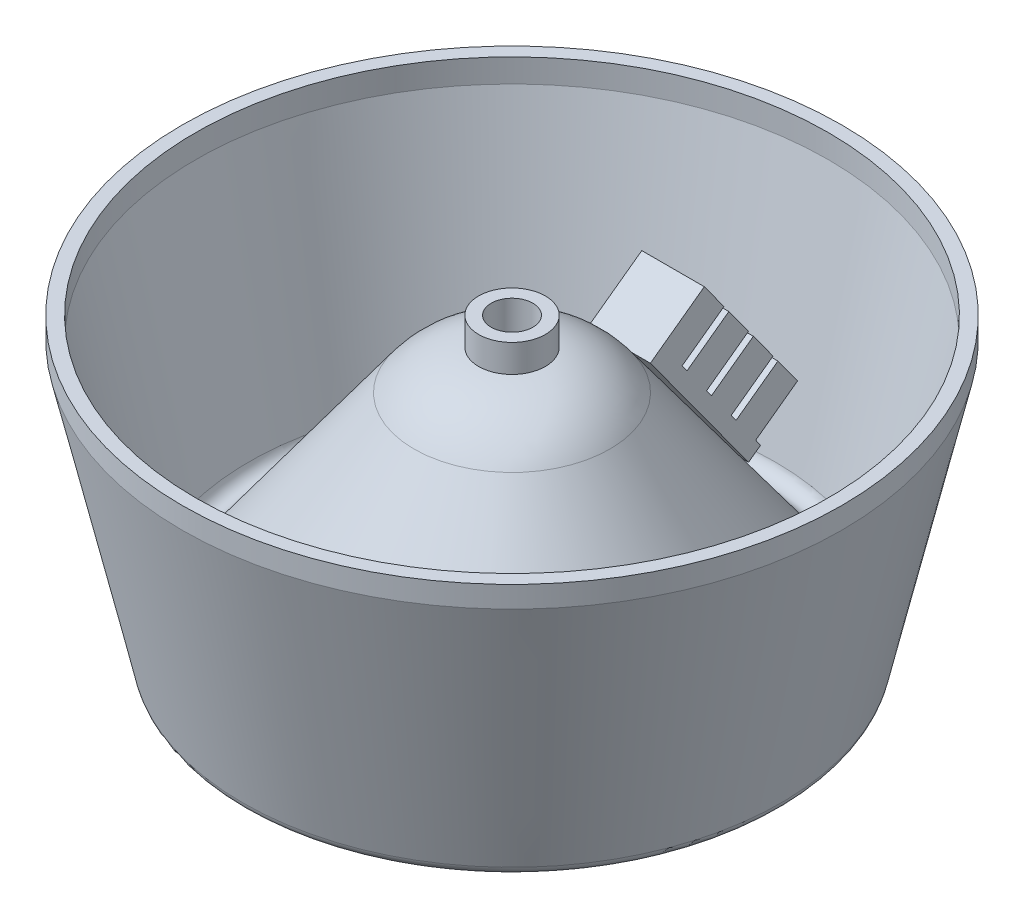
from build123d import *

# Parameters (mm, degrees)
SKETCH2_W           = 15
SKETCH2_H           = 40
BOSS_EXTRUDE3_DEPTH = 1
SKETCH3_W           = 15
SKETCH3_H           = 8
BOSS_EXTRUDE4_DEPTH = 15
SKETCH5_W           = 11
SKETCH5_H           = 6
CUT_EXTRUDE1_DEPTH  = 13
SKETCH6_W           = 15
SKETCH6_H           = 2.584007535
BOSS_EXTRUDE5_DEPTH = 2
LPATTERN1_COUNT     = 4
LPATTERN1_PITCH     = 10


with BuildPart() as part:
    # Sketch1 → Revolve7 (revolve)
    with BuildSketch(Plane(origin=(0, 0, 0), x_dir=(0, 0, -1), z_dir=(1, 0, 0))):
        with BuildLine():
            Line((-59.148631637, -32.404719831), (-21.068373541, 19.926718309))
            ThreePointArc((-21.068373541, 19.926718309), (-14.017788653, 26.011562826), (-5, 28.338700093))
            Line((-5, 28.338700093), (-5, 37.743055381))
            Line((-5, 37.743055381), (-8, 37.743055381))
            Line((-8, 37.743055381), (-8, 31.086362651))
            ThreePointArc((-8, 31.086362651), (-16.691120355, 27.946135354), (-23.494118007, 21.691870932))
            Line((-23.494118007, 21.691870932), (-57.689804939, -25.301231657))
            ThreePointArc((-57.689804939, -25.301231657), (-60.719057067, -26.474748545), (-63.040628712, -24.202345535))
            Line((-63.040628712, -24.202345535), (-75.866843914, 32.107999612))
            Line((-75.866843914, 32.107999612), (-75.866843914, 37.743055381))
            Line((-75.866843914, 37.743055381), (-79.058926618, 37.743055381))
            Line((-79.058926618, 37.743055381), (-79.058926618, 32.613945898))
            Line((-79.058926618, 32.613945898), (-64.499455409, -31.305833709))
            ThreePointArc((-64.499455409, -31.305833709), (-62.177883765, -33.578236719), (-59.148631637, -32.404719831))
        make_face()
    revolve(axis=Axis((0, 0, 0), (0, -1, 0)))


with BuildPart() as body_2:
    # Sketch2 → Boss-Extrude3 (new body)
    with BuildSketch(Plane(origin=(0, 18.687119637, -25.680599191), x_dir=(-1, 0, 0), z_dir=(0, 0.5883842079525278, -0.8085814886775955))):
        with Locations((0, -20)):
            Rectangle(SKETCH2_W, SKETCH2_H)
    extrude(amount=BOSS_EXTRUDE3_DEPTH)

    # Sketch3 → Boss-Extrude4 (add)
    with BuildSketch(Plane(origin=(0, 19.275503845, -26.48918068), x_dir=(-1, 0, 0), z_dir=(0, 0.5883842079525254, -0.8085814886775974))):
        with Locations((0, -4)):
            Rectangle(SKETCH3_W, SKETCH3_H)
    boss_extrude4 = extrude(amount=BOSS_EXTRUDE4_DEPTH)

    # Sketch5 → Cut-Extrude1 (cut)
    with BuildSketch(Plane(origin=(0, 19.275503845, -26.48918068), x_dir=(1, 0, 0), z_dir=(0, -0.5883842079525254, 0.8085814886775974))):
        with Locations((0, -4)):
            Rectangle(SKETCH5_W, SKETCH5_H)
    cut_extrude1 = extrude(amount=-CUT_EXTRUDE1_DEPTH, mode=Mode.SUBTRACT)

    # Sketch6 → Boss-Extrude5 (add)
    with BuildSketch(Plane(origin=(0, -6.468651909, -4.707073664), x_dir=(1, 0, 0), z_dir=(0, -0.8085814886775974, -0.5883842079525254))):
        with Locations((0, -34.052066979)):
            Rectangle(SKETCH6_W, SKETCH6_H)
    boss_extrude5 = extrude(amount=BOSS_EXTRUDE5_DEPTH)

    # LPattern1: Boss-Extrude4, Cut-Extrude1, Boss-Extrude5 ×4
    with Locations(*[Vector(0, -0.8085814886775973, -0.5883842079525254) * (i * LPATTERN1_PITCH) for i in range(1, LPATTERN1_COUNT)]):
        add(boss_extrude4)
        add(cut_extrude1, mode=Mode.SUBTRACT)
        add(boss_extrude5)


solid = Compound([part.part, body_2.part])
